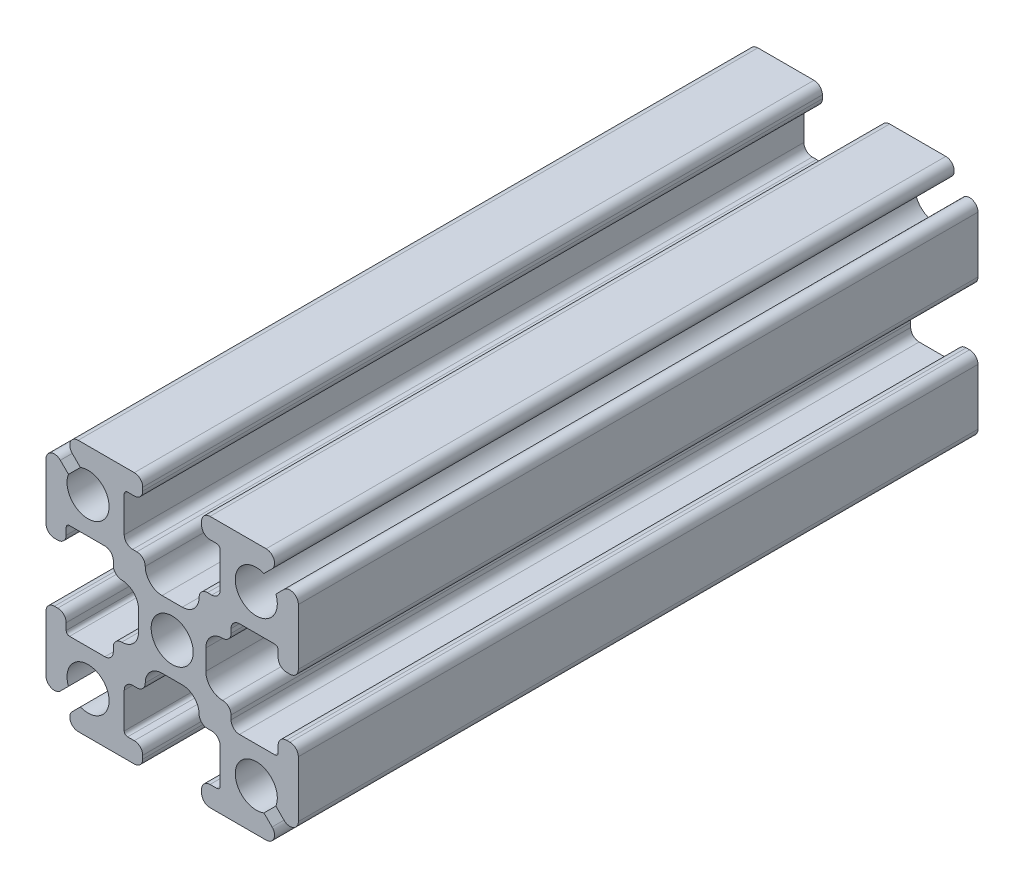
from build123d import *

# Parameters (mm, degrees)
SKETCH1_R           = 1.25
BOSS_EXTRUDE1_DEPTH = 40.4


with BuildPart() as part:
    # Sketch1 → Boss-Extrude1 (new body)
    with BuildSketch(Plane.XY):
        with BuildLine():
            Line((6.646446609, 5.939339828), (6.163645978, 5.456539197))
            ThreePointArc((6.163645978, 5.456539197), (4.116116524, 4.116116524), (5.456539197, 6.163645978))
            Line((5.456539197, 6.163645978), (5.939339828, 6.646446609))
            ThreePointArc((5.939339828, 6.646446609), (6.047726204, 7.191341716), (5.585786438, 7.5))
            Line((5.585786438, 7.5), (2.25, 7.5))
            ThreePointArc((2.25, 7.5), (1.896446609, 7.353553391), (1.75, 7))
            Line((1.75, 7), (1.75, 6.8))
            ThreePointArc((1.75, 6.8), (1.896446609, 6.446446609), (2.25, 6.3))
            Line((2.25, 6.3), (2.65, 6.3))
            ThreePointArc((2.65, 6.3), (2.791421356, 6.241421356), (2.85, 6.1))
            Line((2.85, 6.1), (2.85, 4))
            ThreePointArc((2.85, 4), (2.703553391, 3.646446609), (2.35, 3.5))
            Line((2.35, 3.5), (2.1, 3.5))
            ThreePointArc((2.1, 3.5), (1.746446609, 3.353553391), (1.6, 3))
            ThreePointArc((1.6, 3), (1.307106781, 2.292893219), (0.6, 2))
            Line((0.6, 2), (-0.6, 2))
            ThreePointArc((-0.6, 2), (-1.307106781, 2.292893219), (-1.6, 3))
            ThreePointArc((-1.6, 3), (-1.746446609, 3.353553391), (-2.1, 3.5))
            Line((-2.1, 3.5), (-2.35, 3.5))
            ThreePointArc((-2.35, 3.5), (-2.703553391, 3.646446609), (-2.85, 4))
            Line((-2.85, 4), (-2.85, 6.1))
            ThreePointArc((-2.85, 6.1), (-2.791421356, 6.241421356), (-2.65, 6.3))
            Line((-2.65, 6.3), (-2.25, 6.3))
            ThreePointArc((-2.25, 6.3), (-1.896446609, 6.446446609), (-1.75, 6.8))
            Line((-1.75, 6.8), (-1.75, 7))
            ThreePointArc((-1.75, 7), (-1.896446609, 7.353553391), (-2.25, 7.5))
            Line((-2.25, 7.5), (-5.585786438, 7.5))
            ThreePointArc((-5.585786438, 7.5), (-6.047726204, 7.191341716), (-5.939339828, 6.646446609))
            Line((-5.939339828, 6.646446609), (-5.456539197, 6.163645978))
            ThreePointArc((-5.456539197, 6.163645978), (-4.116116524, 4.116116524), (-6.163645978, 5.456539197))
            Line((-6.163645978, 5.456539197), (-6.646446609, 5.939339828))
            ThreePointArc((-6.646446609, 5.939339828), (-7.191341716, 6.047726204), (-7.5, 5.585786438))
            Line((-7.5, 5.585786438), (-7.5, 2.25))
            ThreePointArc((-7.5, 2.25), (-7.353553391, 1.896446609), (-7, 1.75))
            Line((-7, 1.75), (-6.8, 1.75))
            ThreePointArc((-6.8, 1.75), (-6.446446609, 1.896446609), (-6.3, 2.25))
            Line((-6.3, 2.25), (-6.3, 2.65))
            ThreePointArc((-6.3, 2.65), (-6.241421356, 2.791421356), (-6.1, 2.85))
            Line((-6.1, 2.85), (-4, 2.85))
            ThreePointArc((-4, 2.85), (-3.646446609, 2.703553391), (-3.5, 2.35))
            Line((-3.5, 2.35), (-3.5, 2.1))
            ThreePointArc((-3.5, 2.1), (-3.353553391, 1.746446609), (-3, 1.6))
            ThreePointArc((-3, 1.6), (-2.292893219, 1.307106781), (-2, 0.6))
            Line((-2, 0.6), (-2, -0.6))
            ThreePointArc((-2, -0.6), (-2.292893219, -1.307106781), (-3, -1.6))
            ThreePointArc((-3, -1.6), (-3.353553391, -1.746446609), (-3.5, -2.1))
            Line((-3.5, -2.1), (-3.5, -2.35))
            ThreePointArc((-3.5, -2.35), (-3.646446609, -2.703553391), (-4, -2.85))
            Line((-4, -2.85), (-6.1, -2.85))
            ThreePointArc((-6.1, -2.85), (-6.241421356, -2.791421356), (-6.3, -2.65))
            Line((-6.3, -2.65), (-6.3, -2.25))
            ThreePointArc((-6.3, -2.25), (-6.446446609, -1.896446609), (-6.8, -1.75))
            Line((-6.8, -1.75), (-7, -1.75))
            ThreePointArc((-7, -1.75), (-7.353553391, -1.896446609), (-7.5, -2.25))
            Line((-7.5, -2.25), (-7.5, -5.585786438))
            ThreePointArc((-7.5, -5.585786438), (-7.191341716, -6.047726204), (-6.646446609, -5.939339828))
            Line((-6.646446609, -5.939339828), (-6.163645978, -5.456539197))
            ThreePointArc((-6.163645978, -5.456539197), (-4.116116524, -4.116116524), (-5.456539197, -6.163645978))
            Line((-5.456539197, -6.163645978), (-5.939339828, -6.646446609))
            ThreePointArc((-5.939339828, -6.646446609), (-6.047726204, -7.191341716), (-5.585786438, -7.5))
            Line((-5.585786438, -7.5), (-2.25, -7.5))
            ThreePointArc((-2.25, -7.5), (-1.896446609, -7.353553391), (-1.75, -7))
            Line((-1.75, -7), (-1.75, -6.8))
            ThreePointArc((-1.75, -6.8), (-1.896446609, -6.446446609), (-2.25, -6.3))
            Line((-2.25, -6.3), (-2.65, -6.3))
            ThreePointArc((-2.65, -6.3), (-2.791421356, -6.241421356), (-2.85, -6.1))
            Line((-2.85, -6.1), (-2.85, -4))
            ThreePointArc((-2.85, -4), (-2.703553391, -3.646446609), (-2.35, -3.5))
            Line((-2.35, -3.5), (-2.1, -3.5))
            ThreePointArc((-2.1, -3.5), (-1.746446609, -3.353553391), (-1.6, -3))
            ThreePointArc((-1.6, -3), (-1.307106781, -2.292893219), (-0.6, -2))
            Line((-0.6, -2), (0.6, -2))
            ThreePointArc((0.6, -2), (1.307106781, -2.292893219), (1.6, -3))
            ThreePointArc((1.6, -3), (1.746446609, -3.353553391), (2.1, -3.5))
            Line((2.1, -3.5), (2.35, -3.5))
            ThreePointArc((2.35, -3.5), (2.703553391, -3.646446609), (2.85, -4))
            Line((2.85, -4), (2.85, -6.1))
            ThreePointArc((2.85, -6.1), (2.791421356, -6.241421356), (2.65, -6.3))
            Line((2.65, -6.3), (2.25, -6.3))
            ThreePointArc((2.25, -6.3), (1.896446609, -6.446446609), (1.75, -6.8))
            Line((1.75, -6.8), (1.75, -7))
            ThreePointArc((1.75, -7), (1.896446609, -7.353553391), (2.25, -7.5))
            Line((2.25, -7.5), (5.585786438, -7.5))
            ThreePointArc((5.585786438, -7.5), (6.047726204, -7.191341716), (5.939339828, -6.646446609))
            Line((5.939339828, -6.646446609), (5.456539197, -6.163645978))
            ThreePointArc((5.456539197, -6.163645978), (4.116116524, -4.116116524), (6.163645978, -5.456539197))
            Line((6.163645978, -5.456539197), (6.646446609, -5.939339828))
            ThreePointArc((6.646446609, -5.939339828), (7.191341716, -6.047726204), (7.5, -5.585786438))
            Line((7.5, -5.585786438), (7.5, -2.25))
            ThreePointArc((7.5, -2.25), (7.353553391, -1.896446609), (7, -1.75))
            Line((7, -1.75), (6.8, -1.75))
            ThreePointArc((6.8, -1.75), (6.446446609, -1.896446609), (6.3, -2.25))
            Line((6.3, -2.25), (6.3, -2.65))
            ThreePointArc((6.3, -2.65), (6.241421356, -2.791421356), (6.1, -2.85))
            Line((6.1, -2.85), (4, -2.85))
            ThreePointArc((4, -2.85), (3.646446609, -2.703553391), (3.5, -2.35))
            Line((3.5, -2.35), (3.5, -2.1))
            ThreePointArc((3.5, -2.1), (3.353553391, -1.746446609), (3, -1.6))
            ThreePointArc((3, -1.6), (2.292893219, -1.307106781), (2, -0.6))
            Line((2, -0.6), (2, 0.6))
            ThreePointArc((2, 0.6), (2.292893219, 1.307106781), (3, 1.6))
            ThreePointArc((3, 1.6), (3.353553391, 1.746446609), (3.5, 2.1))
            Line((3.5, 2.1), (3.5, 2.35))
            ThreePointArc((3.5, 2.35), (3.646446609, 2.703553391), (4, 2.85))
            Line((4, 2.85), (6.1, 2.85))
            ThreePointArc((6.1, 2.85), (6.241421356, 2.791421356), (6.3, 2.65))
            Line((6.3, 2.65), (6.3, 2.25))
            ThreePointArc((6.3, 2.25), (6.446446609, 1.896446609), (6.8, 1.75))
            Line((6.8, 1.75), (7, 1.75))
            ThreePointArc((7, 1.75), (7.353553391, 1.896446609), (7.5, 2.25))
            Line((7.5, 2.25), (7.5, 5.585786438))
            ThreePointArc((7.5, 5.585786438), (7.191341716, 6.047726204), (6.646446609, 5.939339828))
        make_face()
        with Locations(Location((0, 0, 0), (0, 0, 180))):
            Circle(SKETCH1_R, mode=Mode.SUBTRACT)
    extrude(amount=BOSS_EXTRUDE1_DEPTH)


solid = part.part
